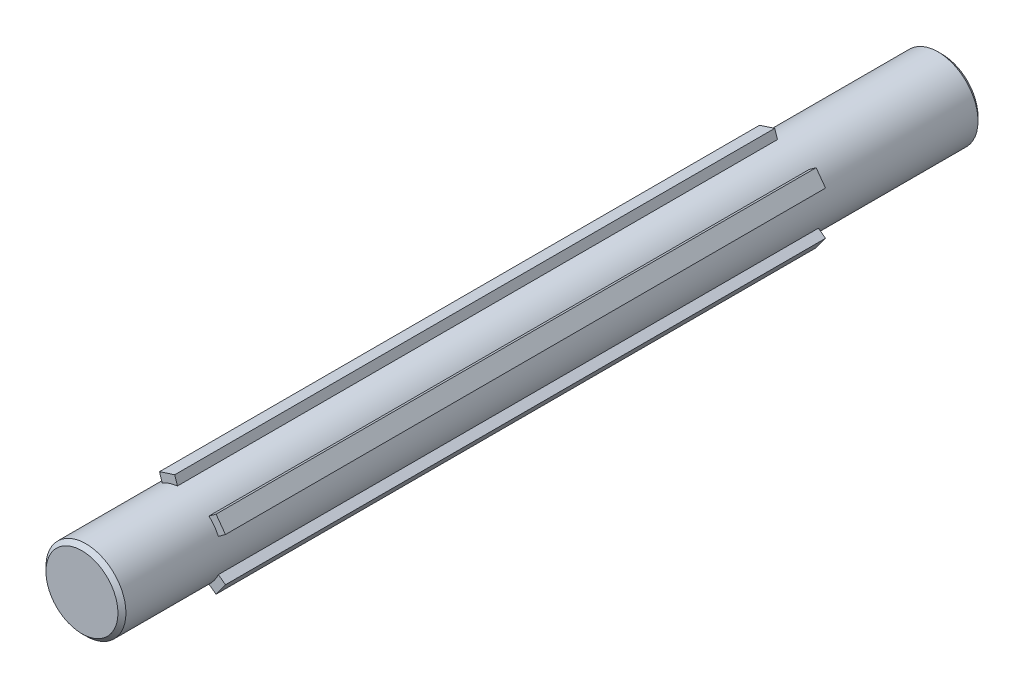
from build123d import *

# Parameters (mm, degrees)
SKETCH1_R           = 10
BOSS_EXTRUDE1_DEPTH = 215
BOSS_EXTRUDE2_START = 40
BOSS_EXTRUDE2_DEPTH = 150
CHAMFER1_SIZE       = 1


with BuildPart() as part:
    # Sketch1 → Boss-Extrude1 (new body)
    with BuildSketch(Plane.XY):
        Circle(SKETCH1_R)
    extrude(amount=BOSS_EXTRUDE1_DEPTH)

    # Sketch1<3> → Boss-Extrude2 (add)
    with BuildSketch(Plane.XY.offset(BOSS_EXTRUDE2_START)):
        with BuildLine():
            Line((-1.8060909, 12.030712184), (-5.610316965, 10.794644207))
            Line((-5.610316965, 10.794644207), (-4.929848865, 8.700378737))
            ThreePointArc((-4.929848865, 8.700378737), (-3.090169944, 9.510565163), (-1.1256228, 9.936446715))
            Line((-1.1256228, 9.936446715), (-1.8060909, 12.030712184))
        make_face()
        with BuildLine():
            ThreePointArc((-9.797958971, -2), (-10, 0), (-9.797958971, 2))
            Line((-9.797958971, 2), (-12, 2))
            Line((-12, 2), (-12, -2))
            Line((-12, -2), (-9.797958971, -2))
        make_face()
        with BuildLine():
            Line((8.532633428, 8.671457016), (6.751144813, 7.377129775))
            ThreePointArc((6.751144813, 7.377129775), (8.090169944, 5.877852523), (9.102285822, 4.141061797))
            Line((9.102285822, 4.141061797), (10.883774437, 5.435389039))
            Line((10.883774437, 5.435389039), (8.532633428, 8.671457016))
        make_face()
        with BuildLine():
            ThreePointArc((-1.1256228, -9.936446715), (-3.090169944, -9.510565163), (-4.929848865, -8.700378737))
            Line((-4.929848865, -8.700378737), (-5.610316965, -10.794644207))
            Line((-5.610316965, -10.794644207), (-1.8060909, -12.030712184))
            Line((-1.8060909, -12.030712184), (-1.1256228, -9.936446715))
        make_face()
        with BuildLine():
            Line((10.883774437, -5.435389039), (9.102285822, -4.141061797))
            ThreePointArc((9.102285822, -4.141061797), (8.090169944, -5.877852523), (6.751144813, -7.377129775))
            Line((6.751144813, -7.377129775), (8.532633428, -8.671457016))
            Line((8.532633428, -8.671457016), (10.883774437, -5.435389039))
        make_face()
    extrude(amount=BOSS_EXTRUDE2_DEPTH)

    # Chamfer1
    chamfer1_edges = [part.edges().sort_by_distance(p)[0] for p in [
        (-10, 0, 215),
        (-10, 0, 0),
    ]]
    chamfer(chamfer1_edges, length=CHAMFER1_SIZE)


solid = part.part
